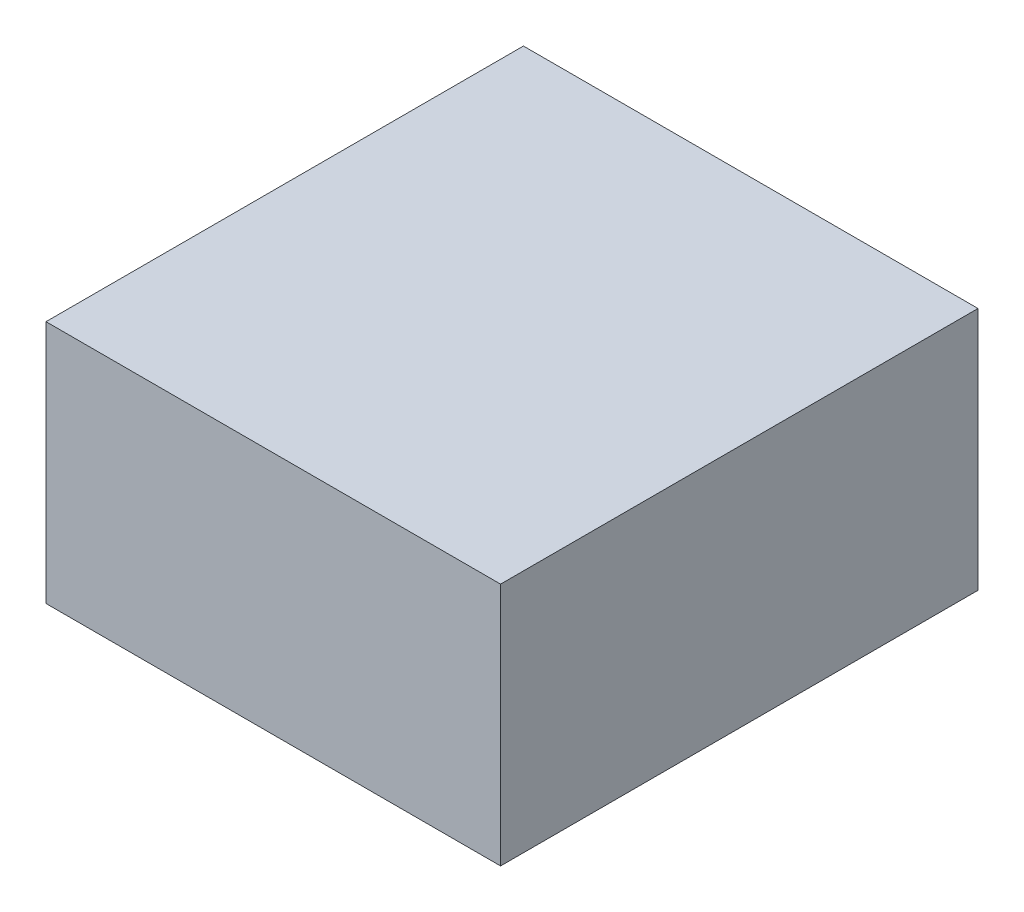
from build123d import *

# Parameters (mm, degrees)
SKETCH3_R           = 28.360772796
BOSS_EXTRUDE4_DEPTH = 50
SKETCH3_2_W         = 93.112965828
SKETCH3_2_H         = 97.794623328
SKETCH3_2_R         = 28.360772796
BOSS_EXTRUDE5_DEPTH = 50


with BuildPart() as part:
    # Sketch3 → Boss-Extrude4 (new body)
    with BuildSketch(Plane(origin=(0, 0, 0), x_dir=(1, 0, 0), z_dir=(0, 1, 0))):
        Circle(SKETCH3_R)
    extrude(amount=BOSS_EXTRUDE4_DEPTH)

    # Sketch3<2> → Boss-Extrude5 (add)
    with BuildSketch(Plane(origin=(0, 0, 0), x_dir=(1, 0, 0), z_dir=(0, 1, 0))):
        Rectangle(SKETCH3_2_W, SKETCH3_2_H)
        Circle(SKETCH3_2_R, mode=Mode.SUBTRACT)
    extrude(amount=BOSS_EXTRUDE5_DEPTH)


solid = part.part
